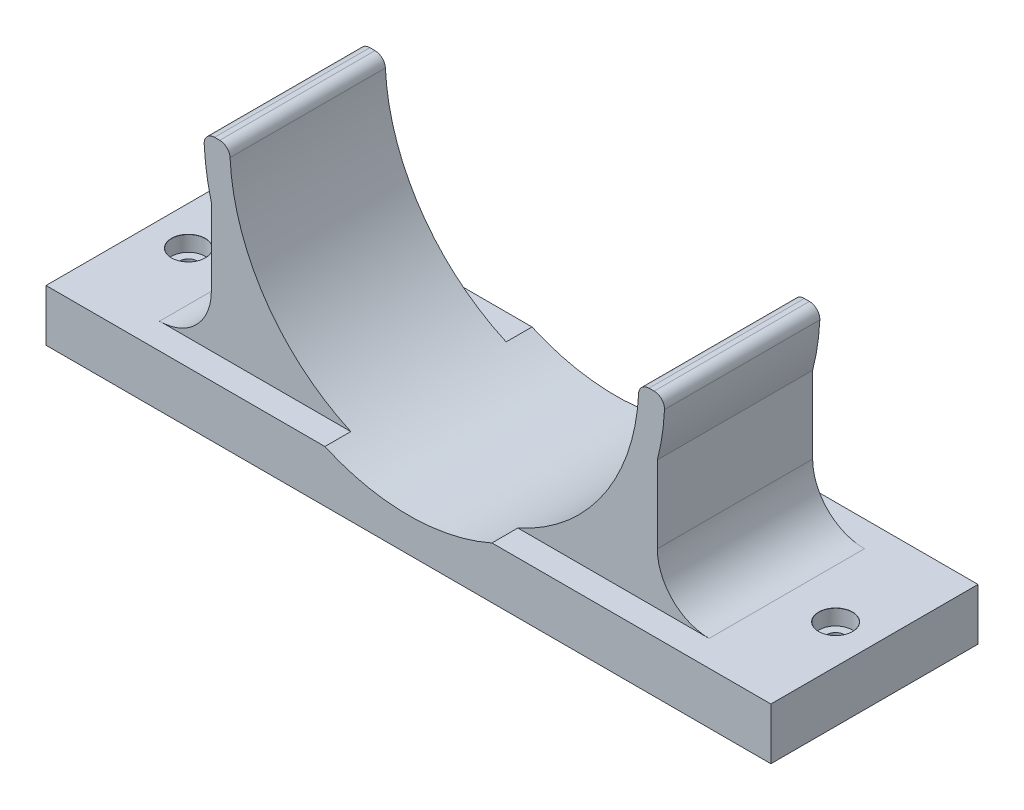
from build123d import *

# Parameters (mm, degrees)
BOSS_EXTRUDE3_DEPTH           = 20
BOSS_EXTRUDE3_DEPTH_BACK      = 20
BOSS_EXTRUDE4_DEPTH           = 15
BOSS_EXTRUDE4_DEPTH_BACK      = 15
BOSS_EXTRUDE5_DEPTH           = 15
BOSS_EXTRUDE5_DEPTH_BACK      = 15
FILLET1_R                     = 10
CBORE_FOR_M3_SHCS1_AT_2_COUNT = 2
CBORE_FOR_M3_SHCS1_AT_2_PITCH = 125
FILLET2_R                     = 2


with BuildPart() as part:
    # Sketch1 → Boss-Extrude3 (new, two sides: drawn at the far end of the back side and taken through both)
    with BuildSketch(Plane.XY.offset(-BOSS_EXTRUDE3_DEPTH_BACK)):
        with BuildLine():
            Line((-43.065388601, -36.056178761), (-70, -36.056178761))
            Line((-70, -36.056178761), (-70, -46.056178761))
            Line((-70, -46.056178761), (70, -46.056178761))
            Line((70, -46.056178761), (70, -36.056178761))
            Line((70, -36.056178761), (43.065388601, -36.056178761))
            Line((43.065388601, -36.056178761), (26.080681992, -36.056178761))
            Line((26.080681992, -36.056178761), (16.130777202, -36.056178761))
            ThreePointArc((16.130777202, -36.056178761), (0, -39.5), (-16.130777202, -36.056178761))
            Line((-16.130777202, -36.056178761), (-26.080681992, -36.056178761))
            Line((-26.080681992, -36.056178761), (-43.065388601, -36.056178761))
        make_face()
    extrude(amount=BOSS_EXTRUDE3_DEPTH + BOSS_EXTRUDE3_DEPTH_BACK)

    # Sketch1<6> → Boss-Extrude4 (add, two sides: drawn at the far end of the back side and taken through both)
    with BuildSketch(Plane.XY.offset(-BOSS_EXTRUDE4_DEPTH_BACK)):
        with BuildLine():
            ThreePointArc((-44.5, 0), (-39.628527279, -20.24425414), (-26.080681992, -36.056178761))
            Line((-26.080681992, -36.056178761), (-16.130777202, -36.056178761))
            ThreePointArc((-16.130777202, -36.056178761), (-33.146762281, -21.483532071), (-39.5, 0))
            Line((-39.5, 0), (-44.5, 0))
        make_face()
        with BuildLine():
            ThreePointArc((39.5, 0), (33.146762281, -21.483532071), (16.130777202, -36.056178761))
            Line((16.130777202, -36.056178761), (26.080681992, -36.056178761))
            ThreePointArc((26.080681992, -36.056178761), (39.628527279, -20.24425414), (44.5, 0))
            Line((44.5, 0), (39.5, 0))
        make_face()
    extrude(amount=BOSS_EXTRUDE4_DEPTH + BOSS_EXTRUDE4_DEPTH_BACK)

    # Sketch1<7> → Boss-Extrude5 (add, two sides: drawn at the far end of the back side and taken through both)
    with BuildSketch(Plane.XY.offset(-BOSS_EXTRUDE5_DEPTH_BACK)):
        with BuildLine():
            Line((-43.065388601, -11.208135645), (-43.065388601, -36.056178761))
            Line((-43.065388601, -36.056178761), (-26.080681992, -36.056178761))
            ThreePointArc((-26.080681992, -36.056178761), (-36.737597653, -25.111728708), (-43.065388601, -11.208135645))
        make_face()
        with BuildLine():
            Line((26.080681992, -36.056178761), (43.065388601, -36.056178761))
            Line((43.065388601, -36.056178761), (43.065388601, -11.208135645))
            ThreePointArc((43.065388601, -11.208135645), (36.737597653, -25.111728708), (26.080681992, -36.056178761))
        make_face()
    extrude(amount=BOSS_EXTRUDE5_DEPTH + BOSS_EXTRUDE5_DEPTH_BACK)

    # Fillet1
    fillet1_edges = [part.edges().sort_by_distance(p)[0] for p in [
        (43.065388601, -36.056178761, 0),
        (-43.065388601, -36.056178761, 0),
    ]]
    fillet(fillet1_edges, radius=FILLET1_R)

    # Sketch4 → CBORE for M3 SHCS1 (revolve, cut)
    with BuildSketch(Plane(origin=(-62.5, -36.056178761, 0), x_dir=(0, 0, 1), z_dir=(1, 0, 0))):
        Polygon((0, 0), (0, 10), (1.7, 10), (1.7, 3), (3.25, 3), (3.25, 0.025), (3.275, 0), align=None)
    cbore_for_m3_shcs1 = revolve(axis=Axis((-62.5, -29.706178761, 0), (0, -1, 0)), mode=Mode.SUBTRACT)

    # CBORE for M3 SHCS1 at 2: CBORE for M3 SHCS1 ×2
    with Locations(*[(i * CBORE_FOR_M3_SHCS1_AT_2_PITCH, 0, 0) for i in range(1, CBORE_FOR_M3_SHCS1_AT_2_COUNT)]):
        add(cbore_for_m3_shcs1, mode=Mode.SUBTRACT)

    # Fillet2
    fillet2_edges = [part.edges().sort_by_distance(p)[0] for p in [
        (-44.5, 0, 0),
        (-39.5, 0, 0),
        (44.5, 0, 0),
        (39.5, 0, 0),
    ]]
    fillet(fillet2_edges, radius=FILLET2_R)


solid = part.part
